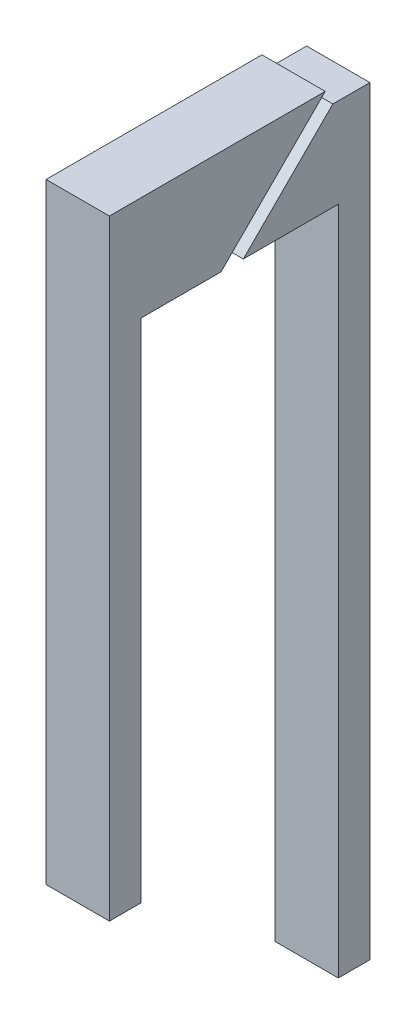
from build123d import *

# Parameters (mm, degrees)
BOSS_EXTRUDE1_DEPTH   = 1
BOSS_EXTRUDE1_2_DEPTH = 1


with BuildPart() as part:
    # Sketch2 → Boss-Extrude1 (new body)
    with BuildSketch(Plane(origin=(0, 0, 0), x_dir=(0, 0, -1), z_dir=(1, 0, 0))):
        Polygon((24.20405768, -32.703304917), (22.789844117, -34.117518479), (24.289844117, -34.117518479), (24.289844117, -44.703304917), (24.789844117, -44.703304917), (24.789844117, -32.703304917), align=None)
    extrude(amount=BOSS_EXTRUDE1_DEPTH)


with BuildPart() as body_2:
    # Sketch2 → Boss-Extrude1 2 (new body)
    with BuildSketch(Plane(origin=(0, 0, 0), x_dir=(0, 0, -1), z_dir=(1, 0, 0))):
        Polygon((24.083729902, -32.471116669), (22.437328092, -34.117518479), (21.174371168, -34.117518479), (21.174371168, -42.117518479), (20.674371168, -42.117518479), (20.674371168, -32.471116669), align=None)
    extrude(amount=BOSS_EXTRUDE1_2_DEPTH)


solid = Compound([part.part, body_2.part])
